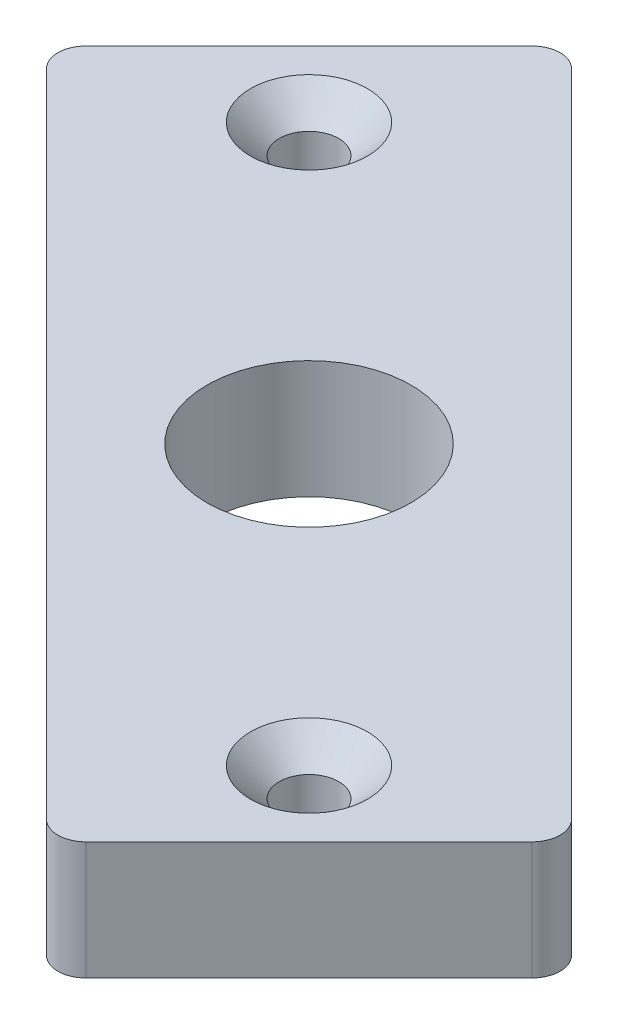
from build123d import *

# Parameters (mm, degrees)
SKETCH2_R                                       = 10.993
BOSS_EXTRUDE1_DEPTH                             = 12.7
CSK_FOR_M6_FLAT_HEAD_MACHINE_SCREW1_D           = 6.4
CSK_FOR_M6_FLAT_HEAD_MACHINE_SCREW1_CSINK_D     = 12.6
CSK_FOR_M6_FLAT_HEAD_MACHINE_SCREW1_CSINK_ANGLE = 90
FILLET1_R                                       = 3


with BuildPart() as part:
    # Sketch2 → Boss-Extrude1 (new body)
    with BuildSketch(Plane(origin=(0, 0, 0), x_dir=(1, 0, 0), z_dir=(0, 1, 0))):
        Polygon((-51.265241636, 22.980970389), (22.980970389, -51.265241636), (51.265241636, -22.980970389), (-22.980970389, 51.265241636), align=None)
        with Locations(Location((0, 0, 0), (0, 0, 270))):
            Circle(SKETCH2_R, mode=Mode.SUBTRACT)
    extrude(amount=-BOSS_EXTRUDE1_DEPTH)

    # CSK for M6 Flat Head Machine Screw1 (through all)
    with Locations(Plane(origin=(-30, 0, -30), x_dir=(0, 0, 1), z_dir=(0, 1, 0))):
        with Locations((0, 0), (60, 60)):
            CounterSinkHole(CSK_FOR_M6_FLAT_HEAD_MACHINE_SCREW1_D / 2, CSK_FOR_M6_FLAT_HEAD_MACHINE_SCREW1_CSINK_D / 2, counter_sink_angle=CSK_FOR_M6_FLAT_HEAD_MACHINE_SCREW1_CSINK_ANGLE)

    # Fillet1
    fillet1_edges = [part.edges().sort_by_distance(p)[0] for p in [
        (-22.980970389, -6.35, -51.265241636),
        (51.265241636, -6.35, 22.980970389),
        (22.980970389, -6.35, 51.265241636),
        (-51.265241636, -6.35, -22.980970389),
    ]]
    fillet(fillet1_edges, radius=FILLET1_R)


solid = part.part
